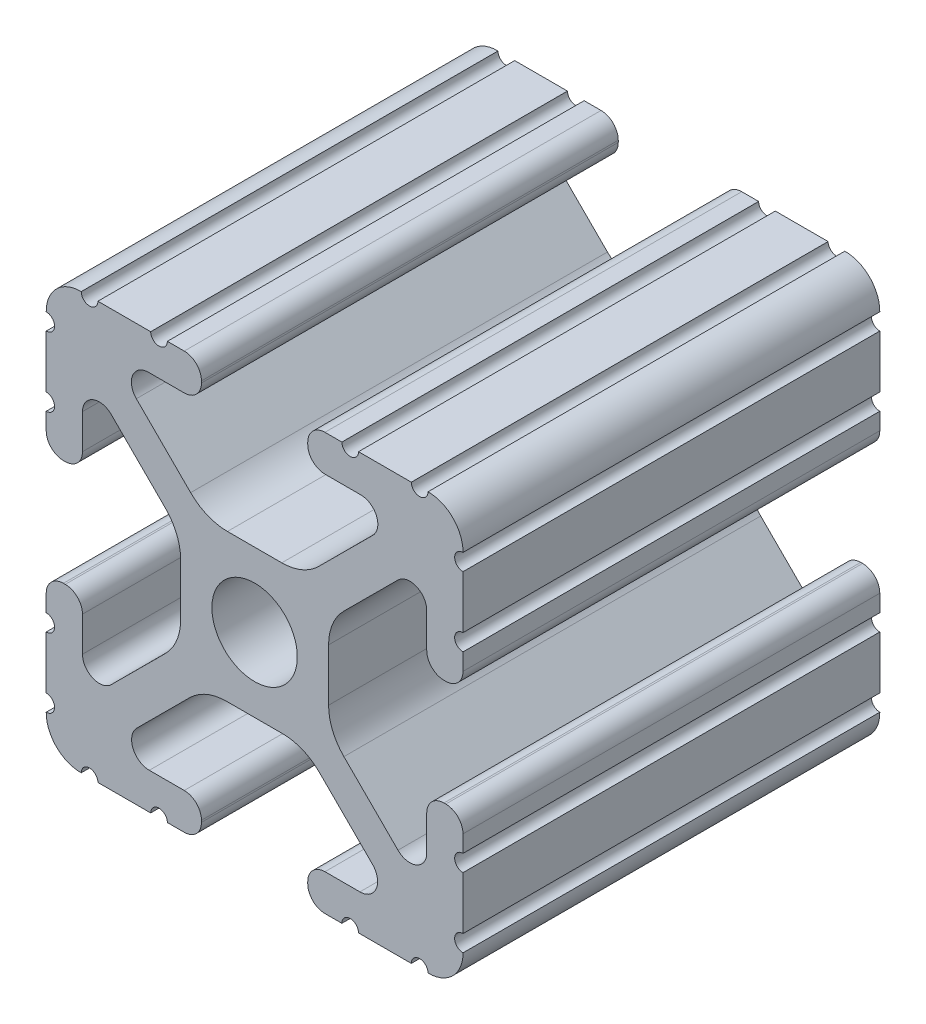
from build123d import *

# Parameters (mm, degrees)
SKETCH1_R           = 2.6035
BOSS_EXTRUDE1_DEPTH = 152.4
SKETCH2_W           = 27.7498742
SKETCH2_H           = 28.906118958
CUT_EXTRUDE1_DEPTH  = 279.4


with BuildPart() as part:
    # Sketch1 → Boss-Extrude1 (new, symmetric)
    with BuildSketch(Plane.XY):
        with BuildLine():
            Line((-7.179650497, -8.645192506), (-3.952270251, -5.423690499))
            ThreePointArc((-3.952270251, -5.423690499), (-2.922936451, -4.736929036), (-1.709253557, -4.4958))
            Line((-1.709253557, -4.4958), (1.709253557, -4.4958))
            ThreePointArc((1.709253557, -4.4958), (2.922936451, -4.736929036), (3.952270251, -5.423690499))
            Line((3.952270251, -5.423690499), (7.179650497, -8.645192506))
            ThreePointArc((7.179650497, -8.645192506), (7.41473083, -9.822813117), (6.416408329, -10.4902))
            Line((6.416408329, -10.4902), (4.287512407, -10.4902))
            ThreePointArc((4.287512407, -10.4902), (3.54574862, -10.79744862), (3.2385, -11.539212407))
            Line((3.2385, -11.539212407), (3.2385, -11.650987593))
            ThreePointArc((3.2385, -11.650987593), (3.54574862, -12.39275138), (4.287512407, -12.7))
            Line((4.287512407, -12.7), (5.317126718, -12.7))
            ThreePointArc((5.317126718, -12.7), (5.825126718, -12.192), (6.333126718, -12.7))
            Line((6.333126718, -12.7), (9.550443118, -12.7))
            ThreePointArc((9.550443118, -12.7), (10.058366869, -12.192000006), (10.566443095, -12.699847501))
            ThreePointArc((10.566443095, -12.699847501), (12.082537762, -12.08250727), (12.699846982, -10.566399977))
            ThreePointArc((12.699846982, -10.566399977), (12.192000006, -10.058323491), (12.7, -9.5504))
            Line((12.7, -9.5504), (12.7, -6.3330836))
            ThreePointArc((12.7, -6.3330836), (12.192, -5.8250836), (12.7, -5.3170836))
            Line((12.7, -5.3170836), (12.7, -4.287469289))
            ThreePointArc((12.7, -4.287469289), (12.39275138, -3.545705502), (11.650987593, -3.238456882))
            Line((11.650987593, -3.238456882), (11.539212407, -3.238456882))
            ThreePointArc((11.539212407, -3.238456882), (10.79744862, -3.545705502), (10.4902, -4.287469289))
            Line((10.4902, -4.287469289), (10.4902, -6.402089023))
            ThreePointArc((10.4902, -6.402089023), (9.856505071, -7.351067942), (8.737131347, -7.129408934))
            Line((8.737131347, -7.129408934), (5.441005833, -3.840816462))
            ThreePointArc((5.441005833, -3.840816462), (4.750877967, -2.809883091), (4.5085, -1.593185507))
            Line((4.5085, -1.593185507), (4.5085, 1.593185507))
            ThreePointArc((4.5085, 1.593185507), (4.750877967, 2.809883091), (5.441005833, 3.840816462))
            Line((5.441005833, 3.840816462), (8.737131347, 7.129408934))
            ThreePointArc((8.737131347, 7.129408934), (9.856505071, 7.351067942), (10.4902, 6.402089023))
            Line((10.4902, 6.402089023), (10.4902, 4.287469289))
            ThreePointArc((10.4902, 4.287469289), (10.79744862, 3.545705502), (11.539212407, 3.238456882))
            Line((11.539212407, 3.238456882), (11.650987593, 3.238456882))
            ThreePointArc((11.650987593, 3.238456882), (12.39275138, 3.545705502), (12.7, 4.287469289))
            Line((12.7, 4.287469289), (12.7, 5.3170836))
            ThreePointArc((12.7, 5.3170836), (12.192, 5.8250836), (12.7, 6.3330836))
            Line((12.7, 6.3330836), (12.7, 9.5504))
            ThreePointArc((12.7, 9.5504), (12.192000006, 10.058323491), (12.699846982, 10.566399977))
            ThreePointArc((12.699846982, 10.566399977), (12.082537762, 12.08250727), (10.566443095, 12.699847501))
            ThreePointArc((10.566443095, 12.699847501), (10.058366869, 12.192000006), (9.550443118, 12.7))
            Line((9.550443118, 12.7), (6.333126718, 12.7))
            ThreePointArc((6.333126718, 12.7), (5.825126718, 12.192), (5.317126718, 12.7))
            Line((5.317126718, 12.7), (4.287512407, 12.7))
            ThreePointArc((4.287512407, 12.7), (3.54574862, 12.39275138), (3.2385, 11.650987593))
            Line((3.2385, 11.650987593), (3.2385, 11.539212407))
            ThreePointArc((3.2385, 11.539212407), (3.54574862, 10.79744862), (4.287512407, 10.4902))
            Line((4.287512407, 10.4902), (6.476788598, 10.4902))
            ThreePointArc((6.476788598, 10.4902), (7.432222385, 9.85140422), (7.207036008, 8.724370562))
            Line((7.207036008, 8.724370562), (3.898272566, 5.423169045))
            ThreePointArc((3.898272566, 5.423169045), (2.869120213, 4.736787962), (1.655778399, 4.4958))
            Line((1.655778399, 4.4958), (-1.655778399, 4.4958))
            ThreePointArc((-1.655778399, 4.4958), (-2.869120213, 4.736787962), (-3.898272566, 5.423169045))
            Line((-3.898272566, 5.423169045), (-7.207036008, 8.724370562))
            ThreePointArc((-7.207036008, 8.724370562), (-7.432222385, 9.85140422), (-6.476788598, 10.4902))
            Line((-6.476788598, 10.4902), (-4.287512407, 10.4902))
            ThreePointArc((-4.287512407, 10.4902), (-3.54574862, 10.79744862), (-3.2385, 11.539212407))
            Line((-3.2385, 11.539212407), (-3.2385, 11.650987593))
            ThreePointArc((-3.2385, 11.650987593), (-3.54574862, 12.39275138), (-4.287512407, 12.7))
            Line((-4.287512407, 12.7), (-5.317126718, 12.7))
            ThreePointArc((-5.317126718, 12.7), (-5.825126718, 12.192), (-6.333126718, 12.7))
            Line((-6.333126718, 12.7), (-9.550443118, 12.7))
            ThreePointArc((-9.550443118, 12.7), (-10.058366869, 12.192000006), (-10.566443095, 12.699847501))
            ThreePointArc((-10.566443095, 12.699847501), (-12.082537762, 12.08250727), (-12.699846982, 10.566399977))
            ThreePointArc((-12.699846982, 10.566399977), (-12.192000006, 10.058323491), (-12.7, 9.5504))
            Line((-12.7, 9.5504), (-12.7, 6.3330836))
            ThreePointArc((-12.7, 6.3330836), (-12.192, 5.8250836), (-12.7, 5.3170836))
            Line((-12.7, 5.3170836), (-12.7, 4.287469289))
            ThreePointArc((-12.7, 4.287469289), (-12.39275138, 3.545705502), (-11.650987593, 3.238456882))
            Line((-11.650987593, 3.238456882), (-11.539212407, 3.238456882))
            ThreePointArc((-11.539212407, 3.238456882), (-10.79744862, 3.545705502), (-10.4902, 4.287469289))
            Line((-10.4902, 4.287469289), (-10.4902, 6.402089023))
            ThreePointArc((-10.4902, 6.402089023), (-9.856505071, 7.351067942), (-8.737131347, 7.129408934))
            Line((-8.737131347, 7.129408934), (-5.441005833, 3.840816462))
            ThreePointArc((-5.441005833, 3.840816462), (-4.750877967, 2.809883091), (-4.5085, 1.593185507))
            Line((-4.5085, 1.593185507), (-4.5085, -1.593185507))
            ThreePointArc((-4.5085, -1.593185507), (-4.750877967, -2.809883091), (-5.441005833, -3.840816462))
            Line((-5.441005833, -3.840816462), (-8.737131347, -7.129408934))
            ThreePointArc((-8.737131347, -7.129408934), (-9.856505071, -7.351067942), (-10.4902, -6.402089023))
            Line((-10.4902, -6.402089023), (-10.4902, -4.287469289))
            ThreePointArc((-10.4902, -4.287469289), (-10.79744862, -3.545705502), (-11.539212407, -3.238456882))
            Line((-11.539212407, -3.238456882), (-11.650987593, -3.238456882))
            ThreePointArc((-11.650987593, -3.238456882), (-12.39275138, -3.545705502), (-12.7, -4.287469289))
            Line((-12.7, -4.287469289), (-12.7, -5.3170836))
            ThreePointArc((-12.7, -5.3170836), (-12.192, -5.8250836), (-12.7, -6.3330836))
            Line((-12.7, -6.3330836), (-12.7, -9.5504))
            ThreePointArc((-12.7, -9.5504), (-12.192000006, -10.058323491), (-12.699846982, -10.566399977))
            ThreePointArc((-12.699846982, -10.566399977), (-12.082537762, -12.08250727), (-10.566443095, -12.699847501))
            ThreePointArc((-10.566443095, -12.699847501), (-10.058366869, -12.192000006), (-9.550443118, -12.7))
            Line((-9.550443118, -12.7), (-6.333126718, -12.7))
            ThreePointArc((-6.333126718, -12.7), (-5.825126718, -12.192), (-5.317126718, -12.7))
            Line((-5.317126718, -12.7), (-4.287512407, -12.7))
            ThreePointArc((-4.287512407, -12.7), (-3.54574862, -12.39275138), (-3.2385, -11.650987593))
            Line((-3.2385, -11.650987593), (-3.2385, -11.539212407))
            ThreePointArc((-3.2385, -11.539212407), (-3.54574862, -10.79744862), (-4.287512407, -10.4902))
            Line((-4.287512407, -10.4902), (-6.416408329, -10.4902))
            ThreePointArc((-6.416408329, -10.4902), (-7.41473083, -9.822813117), (-7.179650497, -8.645192506))
        make_face()
        with Locations(Location((0, 0, 0), (0, 0, 180))):
            Circle(SKETCH1_R, mode=Mode.SUBTRACT)
    extrude(amount=BOSS_EXTRUDE1_DEPTH, both=True)

    # Sketch2 → Cut-Extrude1 (cut)
    with BuildSketch(Plane.XY.offset(152.4)):
        with Locations((0, 0.501039395)):
            Rectangle(SKETCH2_W, SKETCH2_H)
    extrude(amount=-CUT_EXTRUDE1_DEPTH, mode=Mode.SUBTRACT)


solid = part.part
